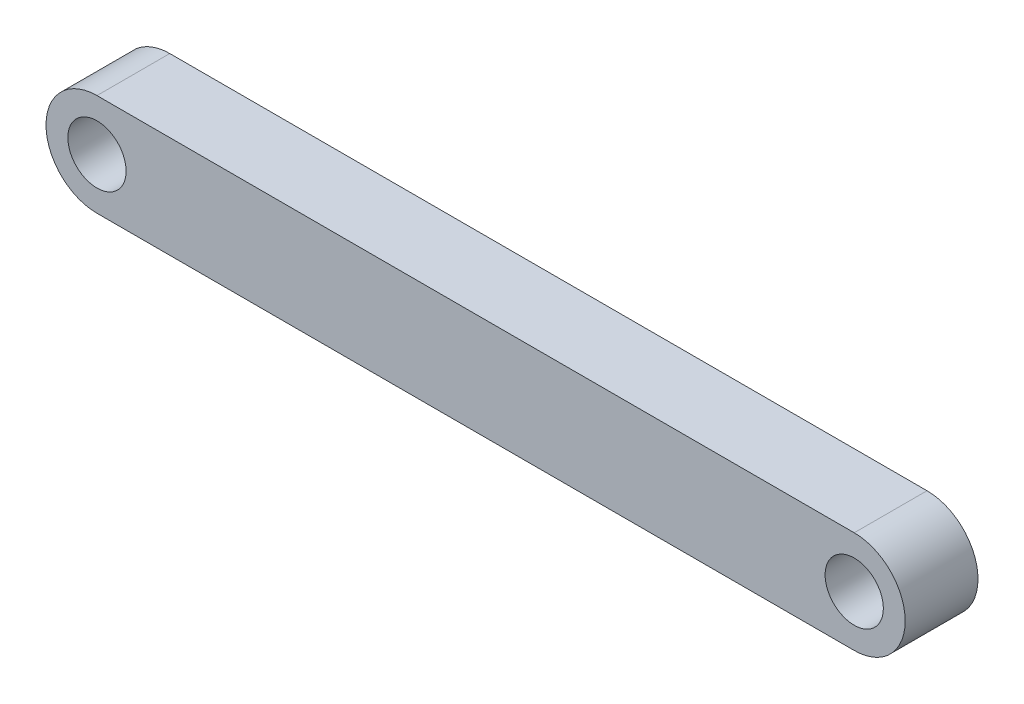
from build123d import *

# Parameters (mm, degrees)
SKETCH1_R           = 2
BOSS_EXTRUDE1_DEPTH = 5


with BuildPart() as part:
    # Sketch1 → Boss-Extrude1 (new body)
    with BuildSketch(Plane.XY):
        with BuildLine():
            Line((-26, -3.5), (26, -3.5))
            ThreePointArc((26, -3.5), (29.5, 0), (26, 3.5))
            Line((26, 3.5), (-26, 3.5))
            ThreePointArc((-26, 3.5), (-29.5, 0), (-26, -3.5))
        make_face()
        with Locations((26, 0)):
            Circle(SKETCH1_R, mode=Mode.SUBTRACT)
        with Locations((-26, 0)):
            Circle(SKETCH1_R, mode=Mode.SUBTRACT)
    extrude(amount=BOSS_EXTRUDE1_DEPTH)


solid = part.part
